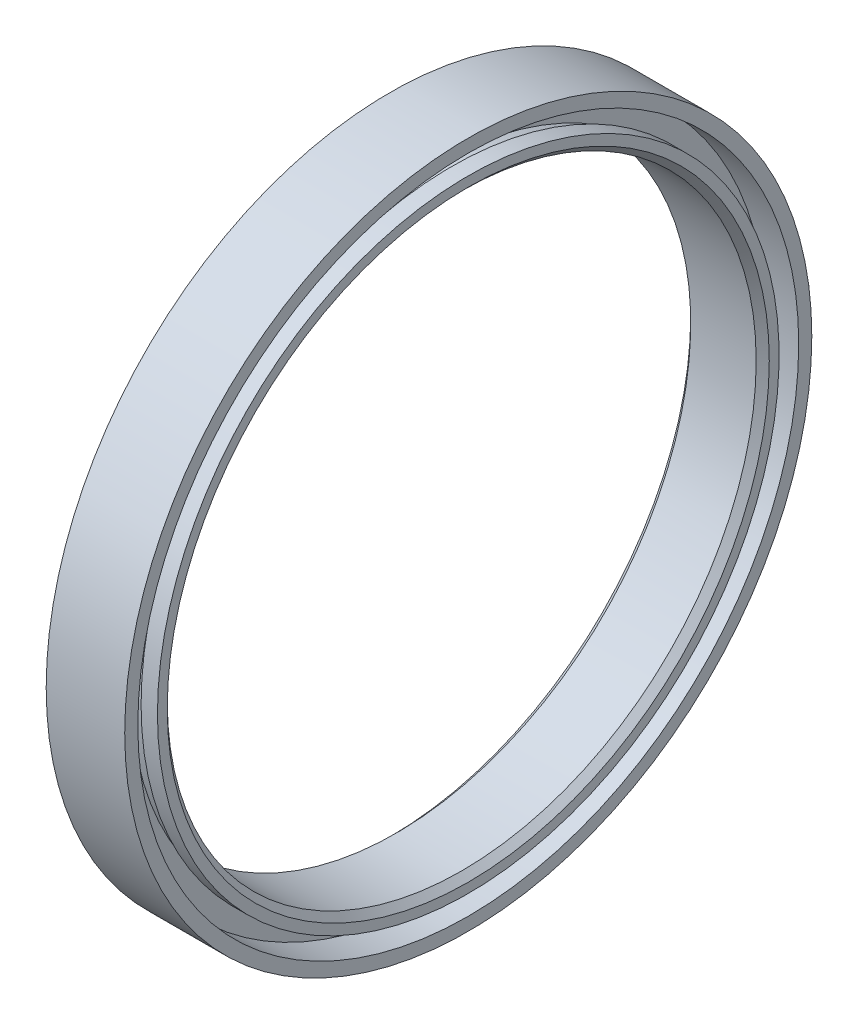
from build123d import *

# Parameters (mm, degrees)
CUT_EXTRUDE_1_DEPTH      = 0.5
PATTERN_CIRCULAR_1_COUNT = 12
CHAMFER_1_SIZE           = 1


with BuildPart() as part:
    # 草图1 → 旋转1 (revolve)
    with BuildSketch(Plane(origin=(0, 0, 0), x_dir=(-1, 0, 0), z_dir=(0, 0, -1)), mode=Mode.PRIVATE) as revolve_1_sk:
        Polygon((-7, 46.5), (-9.5, 46.5), (-9.5, 47.5), (-12, 47.5), (-12, 45), (0, 45), (0, 52.5), (-12, 52.5), (-12, 50.5), (-7, 50.5), align=None)
    revolve(revolve_1_sk.sketch.rotate(Axis((17.910447761, 0, 0), (-1, 0, 0)), 270), axis=Axis((17.910447761, 0, 0), (-1, 0, 0)))

    # 草图2 → 切除-拉伸1 (cut)
    with BuildSketch(Plane.ZY):
        with BuildLine():
            Line((-47.434902901, -2.485957922), (-50.430791505, -2.64296579))
            ThreePointArc((-50.430791505, -2.64296579), (-50.5, 0), (-50.430791505, 2.64296579))
            Line((-50.430791505, 2.64296579), (-47.434902901, 2.485957922))
            ThreePointArc((-47.434902901, 2.485957922), (-47.5, 0), (-47.434902901, -2.485957922))
        make_face()
    cut_extrude_1 = extrude(amount=-CUT_EXTRUDE_1_DEPTH, mode=Mode.SUBTRACT)

    # 阵列(圆周)1: 切除-拉伸1 ×12 about axis
    pattern_circular_1_axis = Axis((0, 0, 0), (1, 0, 0))
    for i in range(1, PATTERN_CIRCULAR_1_COUNT):
        add(cut_extrude_1.rotate(pattern_circular_1_axis, i * 360 / PATTERN_CIRCULAR_1_COUNT), mode=Mode.SUBTRACT)

    # 倒角1
    chamfer_1_edges = [part.edges().sort_by_distance(p)[0] for p in [
        (0, 0, -45),
        (12, 0, -45),
    ]]
    chamfer(chamfer_1_edges, length=CHAMFER_1_SIZE)


solid = part.part
